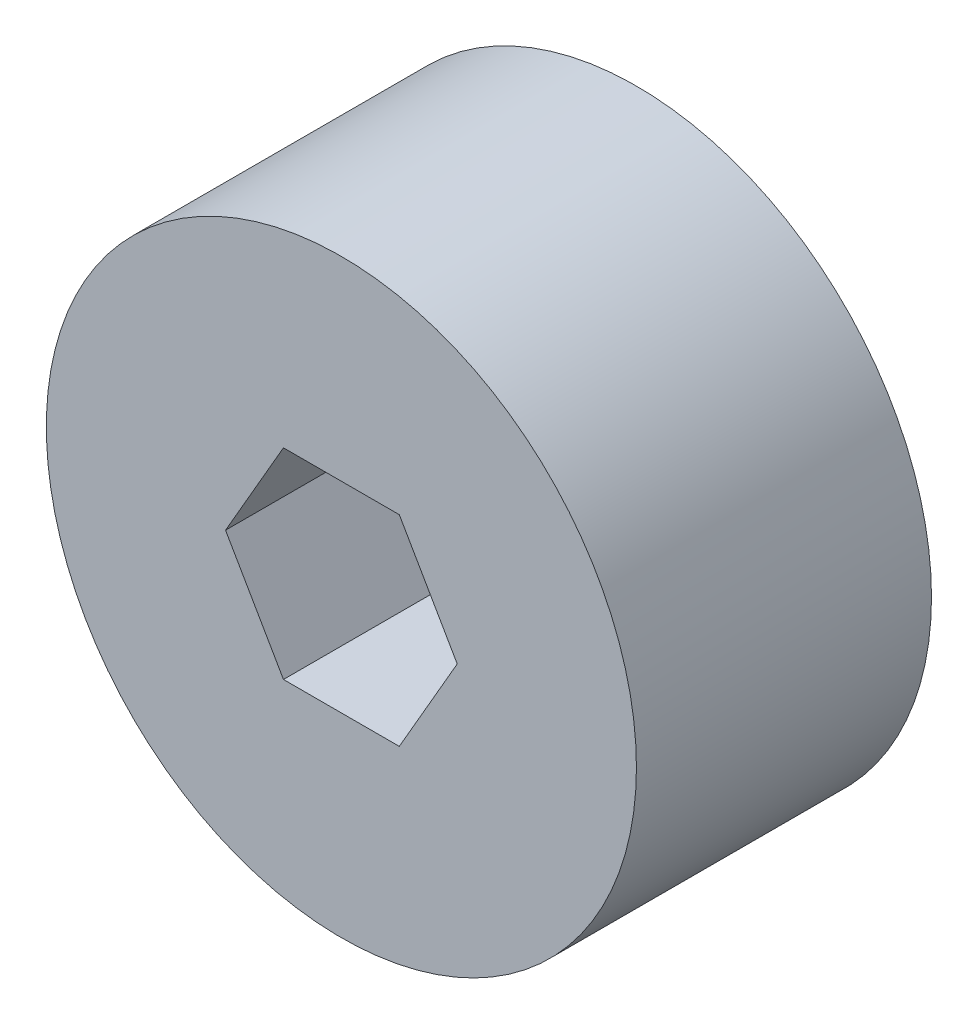
from build123d import *

# Parameters (mm, degrees)
SKETCH2_R           = 12.7
BOSS_EXTRUDE1_DEPTH = 12.7
CUT_EXTRUDE1_DEPTH  = 22.997045256


with BuildPart() as part:
    # Sketch2 → Boss-Extrude1 (new body)
    with BuildSketch(Plane(origin=(0, 0, 0), x_dir=(0, 1, 0), z_dir=(0, 0, 1))):
        with Locations(Location((0, 0, 0), (0, 0, 270))):
            Circle(SKETCH2_R)
    extrude(amount=BOSS_EXTRUDE1_DEPTH)

    # Sketch3 → Cut-Extrude1 (cut, through all)
    with BuildSketch(Plane.XY.offset(12.7)):
        Polygon((-2.492998462, -4.318), (2.492998462, -4.318), (4.985996925, 0), (2.492998462, 4.318), (-2.492998462, 4.318), (-4.985996925, 0), align=None)
    extrude(amount=-CUT_EXTRUDE1_DEPTH, mode=Mode.SUBTRACT)


solid = part.part
